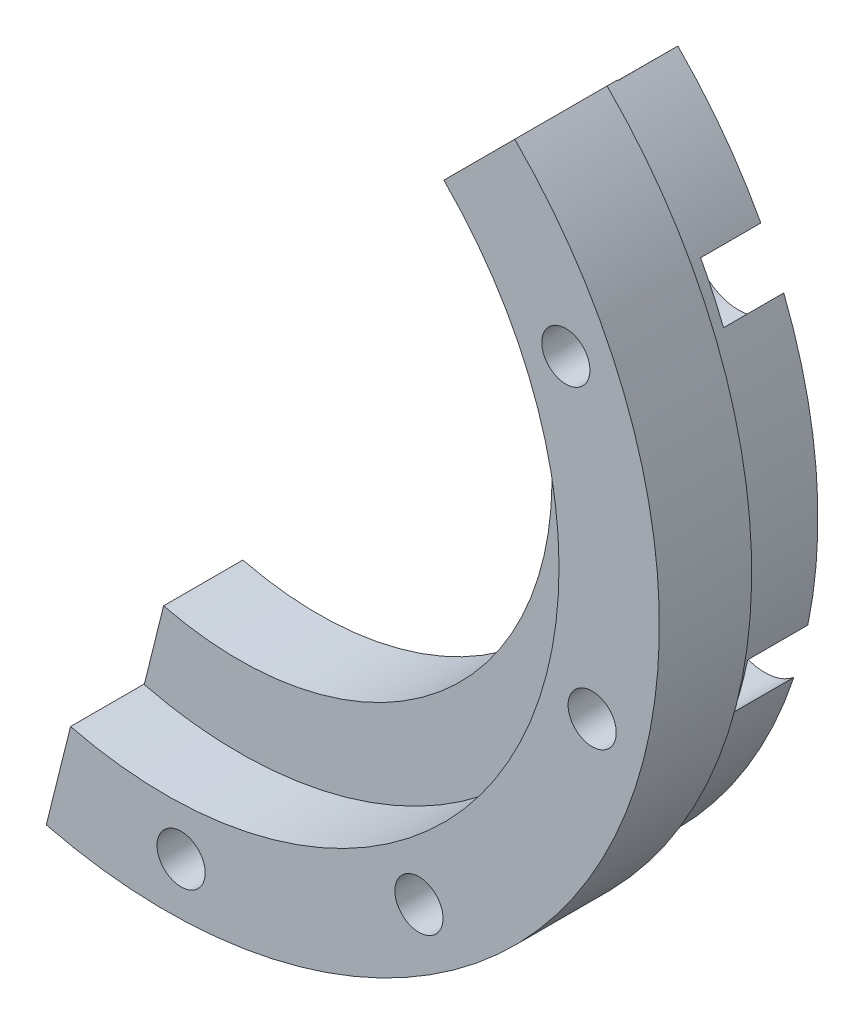
from build123d import *

# Parameters (mm, degrees)
BOSS_1_DEPTH  = 5.6
BOSS_2_DEPTH  = 4.95
CUT_3_DEPTH   = 1.1
CUT_4_DEPTH   = 1.1
S_HOLE5_R     = 1.2
HOLE_5_DEPTH  = 8.8
S_HOLE6_R     = 2.3
HOLE_6_DEPTH  = 3.1
S_HOLE7_R     = 1.2
HOLE_7_DEPTH  = 8.8
S_HOLE8_R     = 2.3
HOLE_8_DEPTH  = 3.1
S_HOLE9_R     = 1.2
HOLE_9_DEPTH  = 8.8
S_HOLE10_R    = 2.3
HOLE_10_DEPTH = 3.1
S_HOLE11_R    = 1.2
HOLE_11_DEPTH = 8.8
S_HOLE12_R    = 2.3
HOLE_12_DEPTH = 3.1


with BuildPart() as part:
    # S_prism1 → Boss_1 (new body)
    with BuildSketch(Plane.XY.offset(24.6)):
        with BuildLine():
            Line((-5.951278632, -23.869274866), (-4.741669154, -19.017796235))
            ThreePointArc((-4.741669154, -19.017796235), (17.05897164, -9.651501778), (13.859292911, 13.859292911))
            Line((13.859292911, 13.859292911), (17.394826817, 17.394826817))
            ThreePointArc((17.394826817, 17.394826817), (21.41075012, -12.113619579), (-5.951278632, -23.869274866))
        make_face()
    extrude(amount=BOSS_1_DEPTH)

    # S_prism2 → Boss_2 (add)
    with BuildSketch(Plane.XY.offset(21.6)):
        with BuildLine():
            Line((-5.753596984, -23.197114513), (-3.755485898, -15.14121282))
            ThreePointArc((-3.755485898, -15.14121282), (13.577548857, -7.681807538), (11.044334296, 11.017380812))
            Line((11.044334296, 11.017380812), (16.920486517, 16.879192399))
            ThreePointArc((16.920486517, 16.879192399), (20.801501133, -11.768923086), (-5.753596984, -23.197114513))
        make_face()
    extrude(amount=BOSS_2_DEPTH)

    # S_pcut3 → Cut_3 (cut)
    with BuildSketch(Plane.XY.offset(24.5)):
        with BuildLine():
            Line((-6.418712319, -23.954960492), (-6.185775178, -23.085627248))
            ThreePointArc((-6.185775178, -23.085627248), (20.801501133, -11.768923086), (16.602335054, 17.192221228))
            Line((16.602335054, 17.192221228), (17.227527587, 17.839627048))
            ThreePointArc((17.227527587, 17.839627048), (21.584821259, -12.212104291), (-6.418712319, -23.954960492))
        make_face()
    extrude(amount=CUT_3_DEPTH, mode=Mode.SUBTRACT)

    # S_pcut4 → Cut_4 (cut)
    with BuildSketch(Plane.XY.offset(21.5)):
        with BuildLine():
            Line((-4.399923767, -16.420739047), (-4.011695199, -14.971850307))
            ThreePointArc((-4.011695199, -14.971850307), (13.490513287, -7.632565182), (10.767204742, 11.149766905))
            Line((10.767204742, 11.149766905), (11.809192298, 12.228776606))
            ThreePointArc((11.809192298, 12.228776606), (14.796046831, -8.371200522), (-4.399923767, -16.420739047))
        make_face()
    extrude(amount=CUT_4_DEPTH, mode=Mode.SUBTRACT)

    # S_hole5 → Hole_5 (cut)
    with BuildSketch(Plane.XY.offset(21.5)):
        with Locations(Location((19.938771315, 9.297601758, 0), (0, 0, 180))):
            Circle(S_HOLE5_R)
    extrude(amount=HOLE_5_DEPTH, mode=Mode.SUBTRACT)

    # S_hole6 → Hole_6 (cut)
    with BuildSketch(Plane.XY.offset(21.5)):
        with Locations((19.938771315, 9.297601758)):
            Circle(S_HOLE6_R)
    extrude(amount=HOLE_6_DEPTH, mode=Mode.SUBTRACT)

    # S_hole7 → Hole_7 (cut)
    with BuildSketch(Plane.XY.offset(21.5)):
        with Locations(Location((21.250368178, -5.694018992, 0), (0, 0, 180))):
            Circle(S_HOLE7_R)
    extrude(amount=HOLE_7_DEPTH, mode=Mode.SUBTRACT)

    # S_hole8 → Hole_8 (cut)
    with BuildSketch(Plane.XY.offset(21.5)):
        with Locations((21.250368178, -5.694018992)):
            Circle(S_HOLE8_R)
    extrude(amount=HOLE_8_DEPTH, mode=Mode.SUBTRACT)

    # S_hole9 → Hole_9 (cut)
    with BuildSketch(Plane.XY.offset(21.5)):
        with Locations(Location((12.6186816, -18.021344974, 0), (0, 0, 180))):
            Circle(S_HOLE9_R)
    extrude(amount=HOLE_9_DEPTH, mode=Mode.SUBTRACT)

    # S_hole10 → Hole_10 (cut)
    with BuildSketch(Plane.XY.offset(21.5)):
        with Locations((12.6186816, -18.021344974)):
            Circle(S_HOLE10_R)
    extrude(amount=HOLE_10_DEPTH, mode=Mode.SUBTRACT)

    # S_hole11 → Hole_11 (cut)
    with BuildSketch(Plane.XY.offset(21.5)):
        with Locations(Location((0.767788927, -21.986598194, 0), (0, 0, 180))):
            Circle(S_HOLE11_R)
    extrude(amount=HOLE_11_DEPTH, mode=Mode.SUBTRACT)

    # S_hole12 → Hole_12 (cut)
    with BuildSketch(Plane.XY.offset(21.5)):
        with Locations((0.767788927, -21.986598194)):
            Circle(S_HOLE12_R)
    extrude(amount=HOLE_12_DEPTH, mode=Mode.SUBTRACT)


solid = part.part
